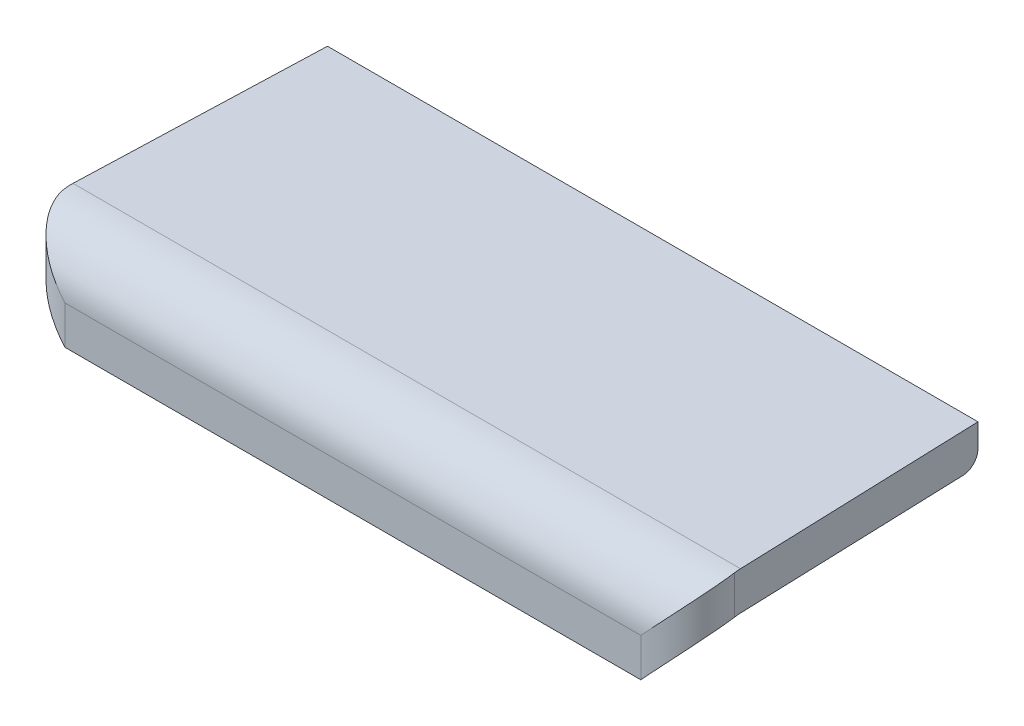
from build123d import *

# Parameters (mm, degrees)
EXTRUDE_1_DEPTH     = 22
SKETCH_2_W          = 44
SKETCH_2_H          = 58
CUT_EXTRUDE_1_DEPTH = 7
FILLET_1_R          = 1
SKETCH_3_R          = 2
EXTRUDE_2_DEPTH     = 10


with BuildPart() as part:
    # Эскиз1 → Бобышка-Вытянуть1 (new, symmetric)
    with BuildSketch(Plane(origin=(0, 0, 0), x_dir=(0, 0, -1), z_dir=(1, 0, 0))):
        with BuildLine():
            Line((-49.5, 0), (0, 0))
            Line((0, 0), (0, -2.5))
            Line((0, -2.5), (-49.5, -2.5))
            ThreePointArc((-49.5, -2.5), (-51.974873734, -3.525126266), (-53, -6))
            Line((-53, -6), (-53, -3.5))
            ThreePointArc((-53, -3.5), (-51.974873734, -1.025126266), (-49.5, 0))
        make_face()
    extrude(amount=EXTRUDE_1_DEPTH, both=True)

    # Эскиз2 → Вырез-Вытянуть1 (cut)
    with BuildSketch(Plane(origin=(0, 0, 0), x_dir=(1, 0, 0), z_dir=(0, 1, 0))):
        with Locations((0, -29)):
            Rectangle(SKETCH_2_W, SKETCH_2_H)
        with BuildLine():
            Line((21.155172414, -33.5), (-21.155172414, -33.5))
            Line((-21.155172414, -33.5), (-21.720572868, -49.896613172))
            ThreePointArc((-21.720572868, -49.896613172), (-20.879918366, -52.084447111), (-18.72235487, -53))
            Line((-18.72235487, -53), (18.72235487, -53))
            ThreePointArc((18.72235487, -53), (20.879918366, -52.084447111), (21.720572868, -49.896613172))
            Line((21.720572868, -49.896613172), (21.155172414, -33.5))
        make_face(mode=Mode.SUBTRACT)
    extrude(amount=-CUT_EXTRUDE_1_DEPTH, mode=Mode.SUBTRACT)

    # Скругление1
    fillet_1_edges = [part.edges().sort_by_distance(p)[0] for p in [
        (0, -2.5, 33.5),
    ]]
    fillet(fillet_1_edges, radius=FILLET_1_R)

    # Эскиз3 → Бобышка-Вытянуть2 (add, symmetric)
    with BuildSketch(Plane(origin=(0, 0, 0), x_dir=(0, 0, -1), z_dir=(1, 0, 0))):
        with BuildLine():
            Line((-47, -8), (-47, -2.5))
            Line((-47, -2.5), (-41, -2.5))
            Line((-41, -2.5), (-41, -8))
            ThreePointArc((-41, -8), (-44, -11), (-47, -8))
        make_face()
        with Locations((-44, -8)):
            Circle(SKETCH_3_R, mode=Mode.SUBTRACT)
    extrude(amount=EXTRUDE_2_DEPTH, both=True)


solid = part.part
